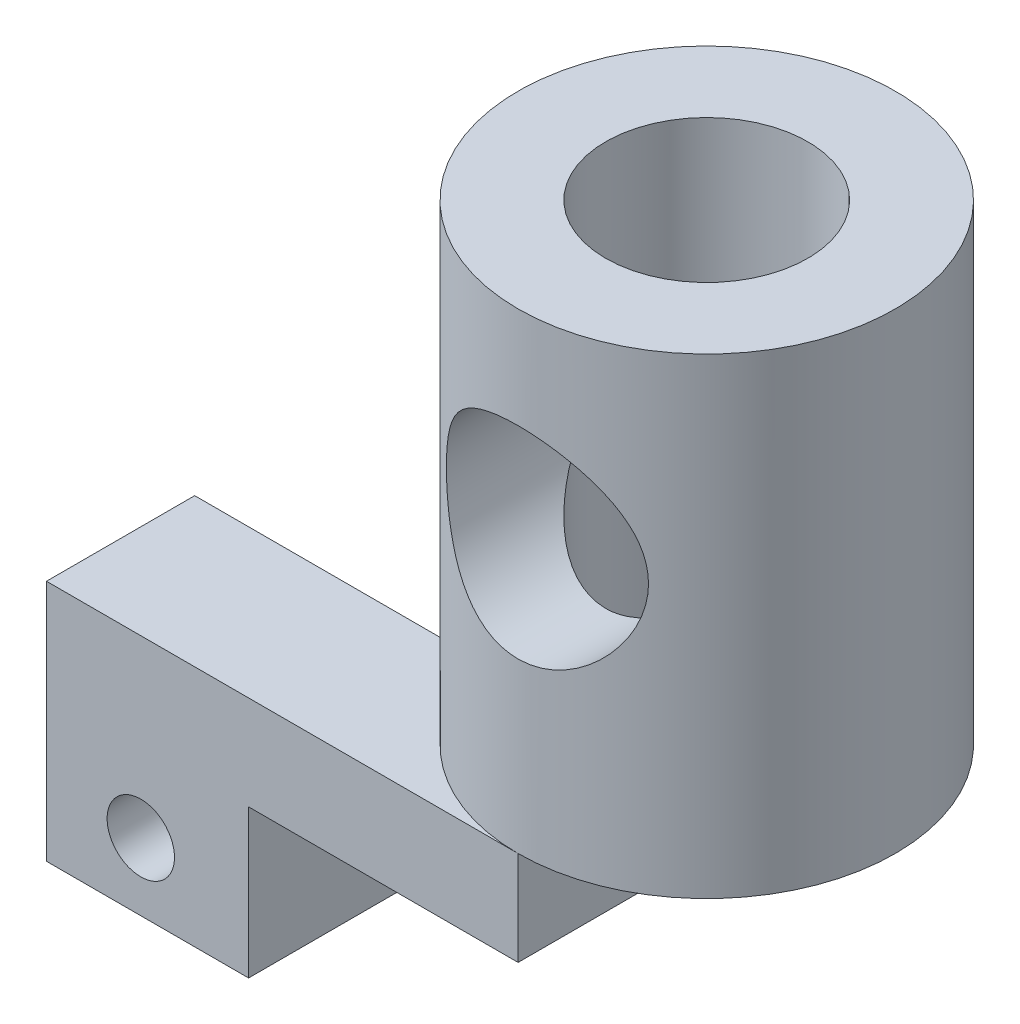
from build123d import *

# Parameters (mm, degrees)
SKETCH_1_R          = 14
SKETCH_1_R_2        = 7.5
EXTRUDE_1_DEPTH     = 35
SKETCH_2_R          = 7.5
CUT_EXTRUDE_1_DEPTH = 35
SKETCH_3_R          = 2.5
EXTRUDE_2_DEPTH     = 14
SKETCH_3_2_R        = 2.5
CUT_EXTRUDE_2_DEPTH = 3


with BuildPart() as part:
    # 草图1 → 凸台-拉伸1 (new body)
    with BuildSketch(Plane(origin=(0, 0, 0), x_dir=(1, 0, 0), z_dir=(0, 1, 0))):
        with Locations((35, 0)):
            Circle(SKETCH_1_R)
        with Locations((35, 0)):
            Circle(SKETCH_1_R_2, mode=Mode.SUBTRACT)
    extrude(amount=EXTRUDE_1_DEPTH)

    # 草图2 → 切除-拉伸1 (cut)
    with BuildSketch(Plane.XY):
        with Locations((35, 20)):
            Circle(SKETCH_2_R)
    extrude(amount=CUT_EXTRUDE_1_DEPTH, mode=Mode.SUBTRACT)

    # 草图3 → 凸台-拉伸2 (add)
    with BuildSketch(Plane.XY):
        Polygon((0, 0), (35, 0), (35, -7), (15, -7), (15, -18), (0, -18), align=None)
        with Locations((7, -13)):
            Circle(SKETCH_3_R, mode=Mode.SUBTRACT)
    extrude(amount=EXTRUDE_2_DEPTH)

    # 草图3<2> → 切除-拉伸2 (cut)
    with BuildSketch(Plane.XY):
        Polygon((0, 0), (35, 0), (35, -7), (15, -7), (15, -18), (0, -18), align=None)
        with Locations((7, -13)):
            Circle(SKETCH_3_2_R, mode=Mode.SUBTRACT)
    extrude(amount=CUT_EXTRUDE_2_DEPTH, mode=Mode.SUBTRACT)


solid = part.part
